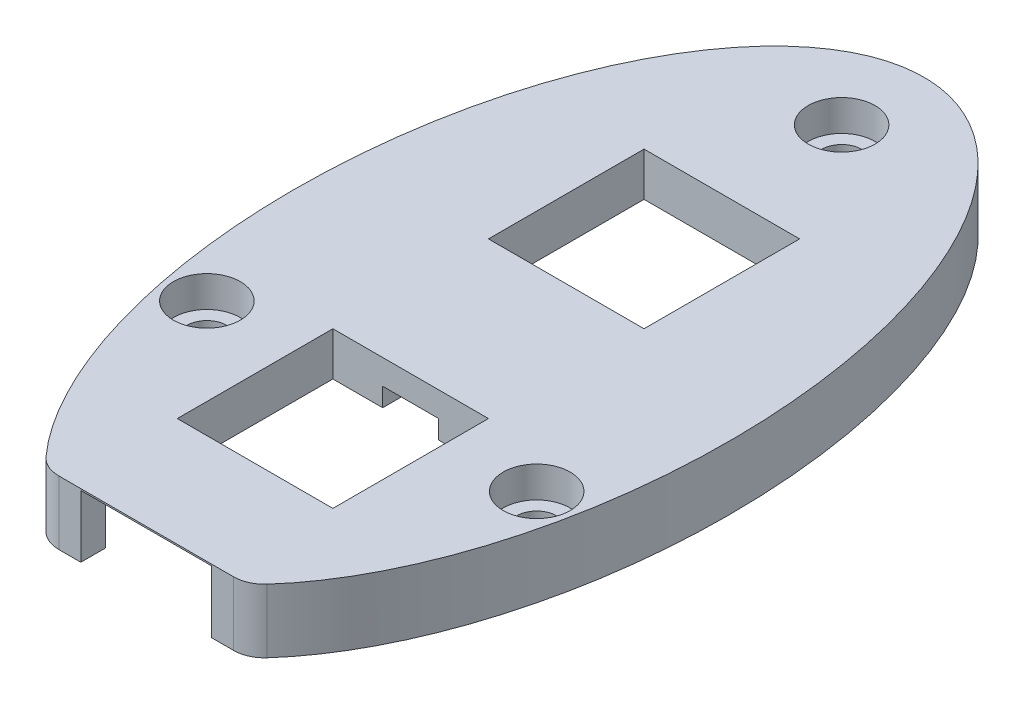
from build123d import *

# Parameters (mm, degrees)
BOSS_EXTRUDE1_DEPTH      = 2.032
SKETCH17_W               = 12.7
SKETCH17_H               = 12.7
CUT_EXTRUDE13_DEPTH      = 39.117141284
LIGHTBOX_DEPTH           = 1.524
SKETCH19_R               = 2.921
SKETCH19_R_2             = 1.6256
BOSS_SCREWS_DEPTH        = 1.524
FLANGEOUTER_DEPTH        = 3.175
CUT_EXTRUDE16_DEPTH      = 39.228687814
CUT_EXTRUDE16_DEPTH_BACK = 39.228687814
SKETCH27_R               = 1.6256
SKETCH28_R               = 2.7305
CUT_EXTRUDE17_DEPTH      = 2.54
CUT_EXTRUDE14_REACH      = 68.147
SKETCH21_W               = 10.668
SKETCH21_H               = 5.08
FILLET1_R                = 2.54


with BuildPart() as part:
    # Sketch1 → Boss-Extrude1 (new body)
    with BuildSketch(Plane(origin=(0, 0, 0), x_dir=(1, 0, 0), z_dir=(0, 1, 0))):
        with BuildLine():
            Line((-8.217344835, -29.845), (8.217344835, -29.845))
            add(Edge.make_bspline(
                [(8.217344835, -29.845), (27.566557431, -10.757067002), (13.783278716, 21.259880795), (0, 53.276828592), (-13.783278716, 21.259880795), (-27.566557431, -10.757067002), (-8.217344835, -29.845)],
                knots=[0.480438272, 0.480438272, 0.480438272, 2.254541193, 2.254541193, 4.028644114, 4.028644114, 5.802747035, 5.802747035, 5.802747035], degree=2, weights=[1, 0.631700514, 1, 0.631700514, 1, 0.631700514, 1]))
        make_face()
    extrude(amount=-BOSS_EXTRUDE1_DEPTH)

    # Sketch17 → Cut-Extrude13 (cut, through all)
    with BuildSketch(Plane(origin=(0, 0, 0), x_dir=(1, 0, 0), z_dir=(0, 1, 0))):
        with Locations((0, 10.795)):
            Rectangle(SKETCH17_W, SKETCH17_H)
        with Locations((0, -14.605)):
            Rectangle(SKETCH17_W, SKETCH17_H)
    extrude(amount=-CUT_EXTRUDE13_DEPTH, mode=Mode.SUBTRACT)

    # Sketch18 → LightBox (add)
    with BuildSketch(Plane(origin=(0, -2.032, 0), x_dir=(1, 0, 0), z_dir=(0, 1, 0))):
        Polygon((-8.382, 19.177), (-8.382, 2.413), (-2.286, 2.413), (-2.286, 4.445), (-6.35, 4.445), (-6.35, 17.145), (6.35, 17.145), (6.35, 4.445), (2.286, 4.445), (2.286, 2.413), (8.382, 2.413), (8.382, 19.177), align=None)
        Polygon((8.382, -22.987), (8.382, -6.223), (2.286, -6.223), (2.286, -8.255), (6.35, -8.255), (6.35, -20.955), (-6.35, -20.955), (-6.35, -8.255), (-2.286, -8.255), (-2.286, -6.223), (-8.382, -6.223), (-8.382, -22.987), align=None)
    extrude(amount=-LIGHTBOX_DEPTH)

    # Sketch19 → Boss-Screws (add)
    # profile 1 of 3: a face of its own
    with BuildSketch(Plane.XZ.offset(2.032)):
        with Locations(Location((13.462, 11.43, 0), (0, 0, 90))):
            Circle(SKETCH19_R)
        with Locations(Location((13.462, 11.43, 0), (0, 0, 90))):
            Circle(SKETCH19_R_2, mode=Mode.SUBTRACT)
    # profile 2 of 3: a face of its own
    with BuildSketch(Plane.XZ.offset(2.032)):
        with Locations(Location((-13.462, 11.43, 0), (0, 0, 90))):
            Circle(SKETCH19_R)
        with Locations(Location((-13.462, 11.43, 0), (0, 0, 90))):
            Circle(SKETCH19_R_2, mode=Mode.SUBTRACT)
    # profile 3 of 3: a face of its own
    with BuildSketch(Plane.XZ.offset(2.032)):
        with Locations(Location((0, -26.924, 0), (0, 0, 90))):
            Circle(SKETCH19_R)
        with Locations(Location((0, -26.924, 0), (0, 0, 90))):
            Circle(SKETCH19_R_2, mode=Mode.SUBTRACT)
    extrude(amount=BOSS_SCREWS_DEPTH)

    # Sketch20 → FlangeOuter (add)
    with BuildSketch(Plane.XZ.offset(2.032)):
        with BuildLine():
            Line((-8.217344835, 29.845), (8.217344835, 29.845))
            add(Edge.make_bspline(
                [(-8.217344835, 29.845), (-27.566557431, 10.757067002), (-13.783278716, -21.259880795), (0, -53.276828592), (13.783278716, -21.259880795), (27.566557431, 10.757067002), (8.217344835, 29.845)],
                knots=[0.480438272, 0.480438272, 0.480438272, 2.254541193, 2.254541193, 4.028644114, 4.028644114, 5.802747035, 5.802747035, 5.802747035], degree=2, weights=[1, 0.631700514, 1, 0.631700514, 1, 0.631700514, 1]))
        make_face()
        with BuildLine():
            Line((-7.355406262, 27.813), (7.355406262, 27.813))
            add(Edge.make_bspline(
                [(-7.355406262, 27.813), (-7.747017683, 27.387563726), (-8.471138622, 26.52297401), (-9.551533082, 24.991678003), (-10.564427624, 23.28989004), (-11.82805854, 20.790783274), (-13.211850279, 17.278236172), (-14.498808643, 12.562661298), (-15.36642142, 7.485512277), (-15.926799764, 0.429414307), (-15.466510788, -8.547813121), (-13.122550811, -18.346344455), (-9.302091217, -26.040627264), (-5.400110306, -29.928766967), (-2.283409012, -31.389489953), (0, -31.739755023), (2.283409012, -31.389489953), (5.400110306, -29.928766967), (9.302091217, -26.040627264), (13.122550811, -18.346344455), (15.466510788, -8.547813121), (15.926799764, 0.429414307), (15.36642142, 7.485512277), (14.498808643, 12.562661298), (13.211850279, 17.278236172), (11.82805854, 20.790783274), (10.564427624, 23.28989004), (9.551533082, 24.991678003), (8.471138622, 26.52297401), (7.747017683, 27.387563726), (7.355406262, 27.813)],
                knots=[0.521032163, 0.521032163, 0.521032163, 0.521032163, 0.602924678, 0.684817193, 0.766709709, 0.848602224, 1.012387255, 1.176172285, 1.339957316, 1.503742347, 1.831312408, 2.15888247, 2.486452531, 2.814022592, 2.977807623, 3.141592654, 3.305377684, 3.469162715, 3.796732776, 4.124302838, 4.451872899, 4.77944296, 4.943227991, 5.107013022, 5.270798052, 5.434583083, 5.516475598, 5.598368114, 5.680260629, 5.762153144, 5.762153144, 5.762153144, 5.762153144], degree=3))
        make_face(mode=Mode.SUBTRACT)
    extrude(amount=FLANGEOUTER_DEPTH)

    # Sketch27 → Cut-Extrude16 (cut, two sides: drawn at the far end of the back side and taken through both)
    with BuildSketch(Plane.XZ.offset(3.556).offset(-CUT_EXTRUDE16_DEPTH_BACK)):
        with Locations(Location((-13.462, 11.43, 0), (0, 0, 123.826495696))):
            Circle(SKETCH27_R)
        with Locations(Location((13.462, 11.43, 0), (0, 0, 56.173504304))):
            Circle(SKETCH27_R)
        with Locations(Location((0, -26.924, 0), (0, 0, 90))):
            Circle(SKETCH27_R)
    extrude(amount=CUT_EXTRUDE16_DEPTH + CUT_EXTRUDE16_DEPTH_BACK, mode=Mode.SUBTRACT)

    # Sketch28 → Cut-Extrude17 (cut)
    with BuildSketch(Plane(origin=(0, 0, 0), x_dir=(1, 0, 0), z_dir=(0, 1, 0))):
        with Locations(Location((-13.462, -11.43, 0), (0, 0, 270))):
            Circle(SKETCH28_R)
        with Locations(Location((13.462, -11.43, 0), (0, 0, 270))):
            Circle(SKETCH28_R)
        with Locations(Location((0, 26.924, 0), (0, 0, 270))):
            Circle(SKETCH28_R)
    extrude(amount=-CUT_EXTRUDE17_DEPTH, mode=Mode.SUBTRACT)

    # Sketch21 → Cut-Extrude14 (cut, up to next)
    with BuildSketch(Plane.XY.offset(29.845), mode=Mode.PRIVATE) as cut_extrude14_sk1:
        with Locations((0, -2.667)):
            Rectangle(SKETCH21_W, SKETCH21_H)
    cut_extrude14_tool1 = extrude(cut_extrude14_sk1.sketch, amount=-CUT_EXTRUDE14_REACH, mode=Mode.PRIVATE) & part.part
    add(cut_extrude14_tool1.solids().sort_by_distance((0, -2.667, 29.845))[0], mode=Mode.SUBTRACT)

    # Fillet1
    fillet1_edges = [part.edges().sort_by_distance(p)[0] for p in [
        (8.217344835, -3.6195, 29.845),
        (-8.217344835, -3.6195, 29.845),
    ]]
    fillet(fillet1_edges, radius=FILLET1_R)


solid = part.part
